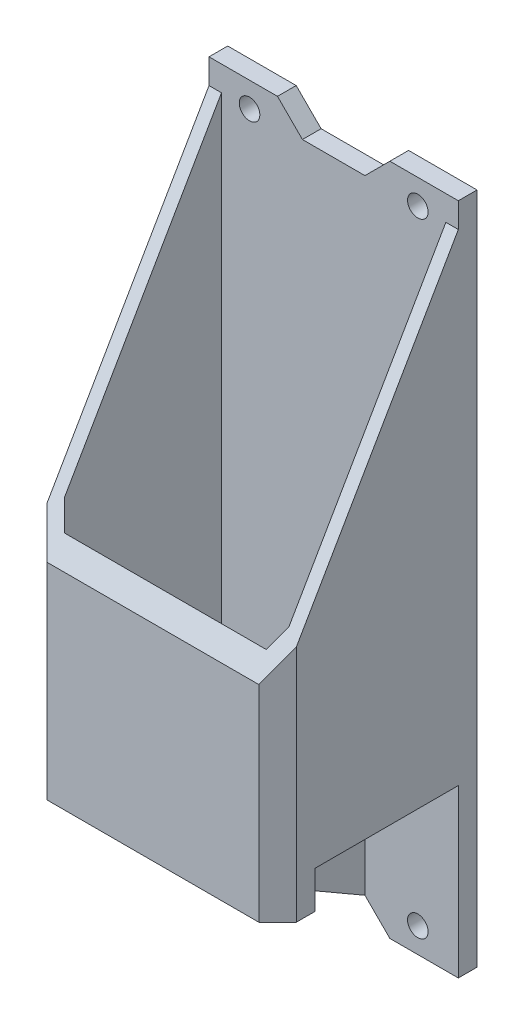
from build123d import *

# Parameters (mm, degrees)
SKETCH1_R           = 1.65
BOSS_EXTRUDE1_DEPTH = 3
BOSS_EXTRUDE2_DEPTH = 40
CHAMFER1_SIZE       = 3
CUT_EXTRUDE3_START  = -29
SKETCH4_W           = 14.985281374
SKETCH4_H           = 16.743157806
SKETCH4_W_2         = 6.029437252
CUT_EXTRUDE3_DEPTH  = 29
CUT_EXTRUDE4_DEPTH  = 86
CUT_EXTRUDE5_DEPTH  = 6


with BuildPart() as part:
    # Sketch1 → Boss-Extrude1 (new body)
    with BuildSketch(Plane.XY):
        Polygon((-20, 104), (-20, -4), (-9.014718626, -4), (-5.014718626, 0), (5.014718626, 0), (9.014718626, -4), (20, -4), (20, 104), (9.014718626, 104), (5.014718626, 100), (-5.014718626, 100), (-9.014718626, 104), align=None)
        with Locations((-13.5, 100)):
            Circle(SKETCH1_R, mode=Mode.SUBTRACT)
        with Locations((-13.5, 0)):
            Circle(SKETCH1_R, mode=Mode.SUBTRACT)
        with Locations(Location((13.5, 0, 0), (0, 0, 180))):
            Circle(SKETCH1_R, mode=Mode.SUBTRACT)
        with Locations(Location((13.5, 100, 0), (0, 0, 180))):
            Circle(SKETCH1_R, mode=Mode.SUBTRACT)
    extrude(amount=BOSS_EXTRUDE1_DEPTH)

    # Sketch2 → Boss-Extrude2 (add, through all)
    with BuildSketch(Plane.ZY.offset(20)):
        Polygon((3, 0), (32, 16.743157806), (32, 49.770526581), (3, 100), align=None)
    extrude(amount=-BOSS_EXTRUDE2_DEPTH)

    # Chamfer1
    chamfer1_edges = [part.edges().sort_by_distance(p)[0] for p in [
        (20, 33.256842194, 32),
        (-20, 33.256842194, 32),
    ]]
    chamfer(chamfer1_edges, length=CHAMFER1_SIZE)

    # Sketch4 → Cut-Extrude3 (cut)
    with BuildSketch(Plane.XY.offset(32).offset(CUT_EXTRUDE3_START)):
        with Locations((-12.507359313, 8.371578903)):
            Rectangle(SKETCH4_W, SKETCH4_H)
        with Locations((12.507359313, 8.371578903)):
            Rectangle(SKETCH4_W, SKETCH4_H)
        with Locations((0, 8.371578903)):
            Rectangle(SKETCH4_W_2, SKETCH4_H)
    extrude(amount=CUT_EXTRUDE3_DEPTH, mode=Mode.SUBTRACT)

    # Sketch5 → Cut-Extrude4 (cut)
    with BuildSketch(Plane(origin=(0, 104, 0), x_dir=(1, 0, 0), z_dir=(0, 1, 0))):
        Polygon((18, -3), (18, -28.171572875), (16.171572875, -30), (-16.171572875, -30), (-18, -28.171572875), (-18, -3), align=None)
    extrude(amount=-CUT_EXTRUDE4_DEPTH, mode=Mode.SUBTRACT)

    # Sketch6 → Cut-Extrude5 (cut)
    with BuildSketch(Plane(origin=(0, 16.743157806, 0), x_dir=(-1, 0, 0), z_dir=(0, -1, 0))):
        Polygon((5.014718626, -29), (15.757359313, -29), (18.757359313, -26), (20.757359313, -26), (20.757359313, -3), (5.014718626, -3), align=None)
        Polygon((-5.014718626, -3), (-5.014718626, -29), (-15.757359313, -29), (-18.757359313, -26), (-20.757359313, -26), (-20.757359313, -3), align=None)
    extrude(amount=-CUT_EXTRUDE5_DEPTH, mode=Mode.SUBTRACT)


solid = part.part
